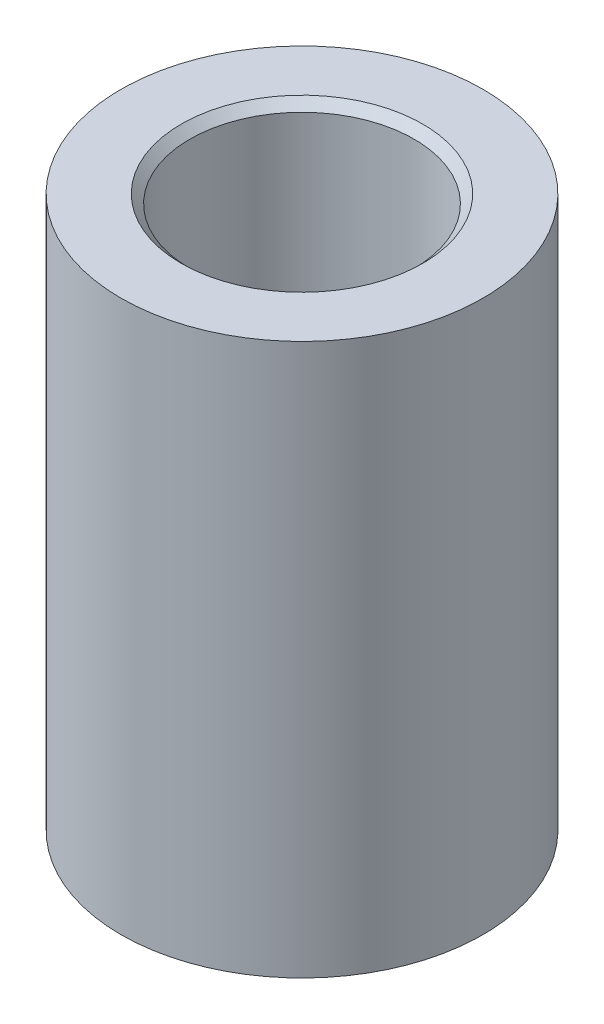
from build123d import *

# Parameters (mm, degrees)
SKETCH1_R           = 8.3375
SKETCH1_R_2         = 5.1625
BOSS_EXTRUDE1_DEPTH = 25.4
CHAMFER1_SIZE       = 0.4


with BuildPart() as part:
    # Sketch1 → Boss-Extrude1 (new body)
    with BuildSketch(Plane(origin=(0, 0, 0), x_dir=(1, 0, 0), z_dir=(0, 1, 0))):
        with Locations(Location((0, 0, 0), (0, 0, 270))):
            Circle(SKETCH1_R)
        with Locations(Location((0, 0, 0), (0, 0, 270))):
            Circle(SKETCH1_R_2, mode=Mode.SUBTRACT)
    extrude(amount=BOSS_EXTRUDE1_DEPTH)

    # Chamfer1
    chamfer1_edges = [part.edges().sort_by_distance(p)[0] for p in [
        (0, 0, -5.1625),
        (0, 25.4, -5.1625),
    ]]
    chamfer(chamfer1_edges, length=CHAMFER1_SIZE)


solid = part.part
